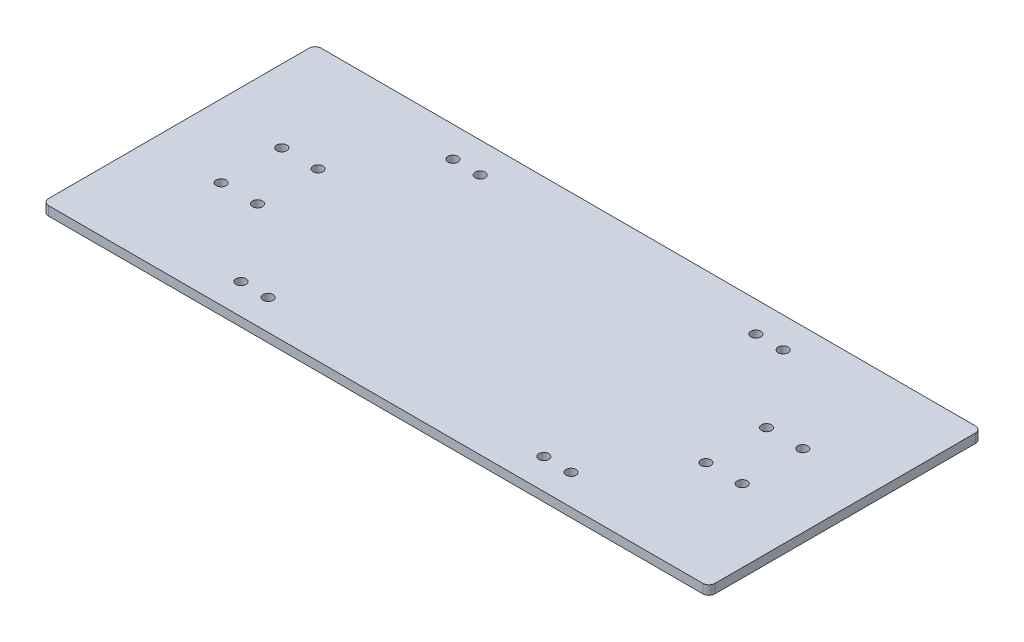
from build123d import *

# Parameters (mm, degrees)
SKETCH_1_W          = 220
SKETCH_1_H          = 90
EXTRUDE_1_DEPTH     = 3
SKETCH_4_R          = 1.65
CUT_EXTRUDE_2_DEPTH = 3
FILLET_1_R          = 2
SKETCH_5_R          = 1.65
CUT_EXTRUDE_3_DEPTH = 10


with BuildPart() as part:
    # 草图1 → 凸台-拉伸1 (new body)
    with BuildSketch(Plane(origin=(0, 0, 0), x_dir=(1, 0, 0), z_dir=(0, 1, 0))):
        Rectangle(SKETCH_1_W, SKETCH_1_H)
    extrude(amount=EXTRUDE_1_DEPTH)

    # 草图4 → 切除-拉伸2 (cut)
    with BuildSketch(Plane(origin=(0, 3, 0), x_dir=(1, 0, 0), z_dir=(0, 1, 0))):
        with Locations(Location((54.5, 35, 0), (0, 0, 270))):
            Circle(SKETCH_4_R)
        with Locations(Location((45.5, 35, 0), (0, 0, 270))):
            Circle(SKETCH_4_R)
        with Locations(Location((-54.5, 35, 0), (0, 0, 90))):
            Circle(SKETCH_4_R)
        with Locations(Location((-45.5, 35, 0), (0, 0, 90))):
            Circle(SKETCH_4_R)
    cut_extrude_2 = extrude(amount=-CUT_EXTRUDE_2_DEPTH, mode=Mode.SUBTRACT)

    # 镜向1: 切除-拉伸2 across plane
    add(cut_extrude_2.mirror(Plane.XY), mode=Mode.SUBTRACT)

    # 圆角1
    fillet_1_edges = [part.edges().sort_by_distance(p)[0] for p in [
        (110, 1.5, 45),
        (-110, 1.5, 45),
        (-110, 1.5, -45),
        (110, 1.5, -45),
    ]]
    fillet(fillet_1_edges, radius=FILLET_1_R)

    # 草图5 → 切除-拉伸3 (cut)
    with BuildSketch(Plane(origin=(0, 3, 0), x_dir=(1, 0, 0), z_dir=(0, 1, 0))):
        with Locations(Location((86, 10, 0), (0, 0, 270))):
            Circle(SKETCH_5_R)
        with Locations(Location((74, 10, 0), (0, 0, 270))):
            Circle(SKETCH_5_R)
        with Locations(Location((74, -10, 0), (0, 0, 270))):
            Circle(SKETCH_5_R)
        with Locations(Location((86, -10, 0), (0, 0, 270))):
            Circle(SKETCH_5_R)
    cut_extrude_3 = extrude(amount=-CUT_EXTRUDE_3_DEPTH, mode=Mode.SUBTRACT)

    # 镜向3: 切除-拉伸3 across plane
    add(cut_extrude_3.mirror(Plane(origin=(0, 0, 0), x_dir=(0, 0, 1), z_dir=(1, 0, 0))), mode=Mode.SUBTRACT)


solid = part.part
